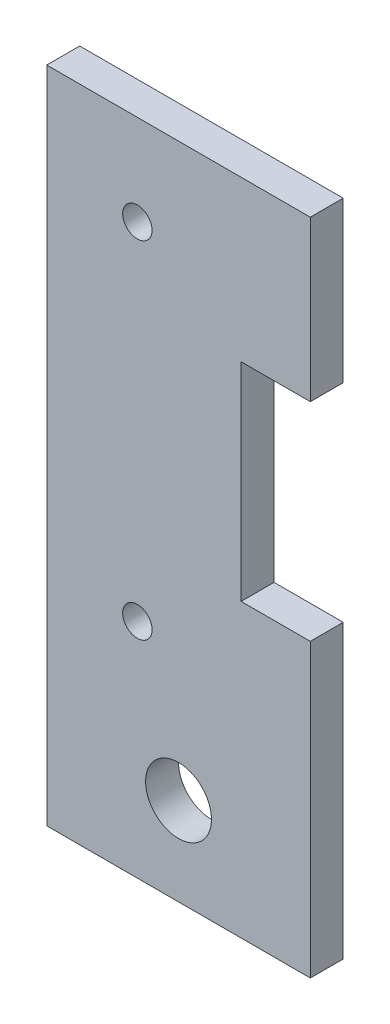
from build123d import *

# Parameters (mm, degrees)
SKETCH2_W           = 38.1
SKETCH2_H           = 95.25
BOSS_EXTRUDE1_DEPTH = 4.7625
SKETCH3_R           = 2.125
SKETCH3_R_2         = 4.7625
SKETCH3_W           = 10
SKETCH3_H           = 30
CUT_EXTRUDE3_DEPTH  = 69.850663804


with BuildPart() as part:
    # Sketch2 → Boss-Extrude1 (new body)
    with BuildSketch(Plane.XY):
        with Locations((-19.05, -9.525)):
            Rectangle(SKETCH2_W, SKETCH2_H)
    extrude(amount=BOSS_EXTRUDE1_DEPTH)

    # Sketch3 → Cut-Extrude3 (cut, through all)
    with BuildSketch(Plane.XY):
        with Locations(Location((-25, 25, 0), (0, 0, 180))):
            Circle(SKETCH3_R)
        with Locations((25, 25)):
            Circle(SKETCH3_R)
        with Locations((25, -25)):
            Circle(SKETCH3_R)
        with Locations(Location((-25, -25, 0), (0, 0, 180))):
            Circle(SKETCH3_R)
        with Locations(Location((-19.05, -44.45, 0), (0, 0, 180))):
            Circle(SKETCH3_R_2)
        with Locations((-5, 0)):
            Rectangle(SKETCH3_W, SKETCH3_H)
    extrude(amount=CUT_EXTRUDE3_DEPTH, mode=Mode.SUBTRACT)


solid = part.part
